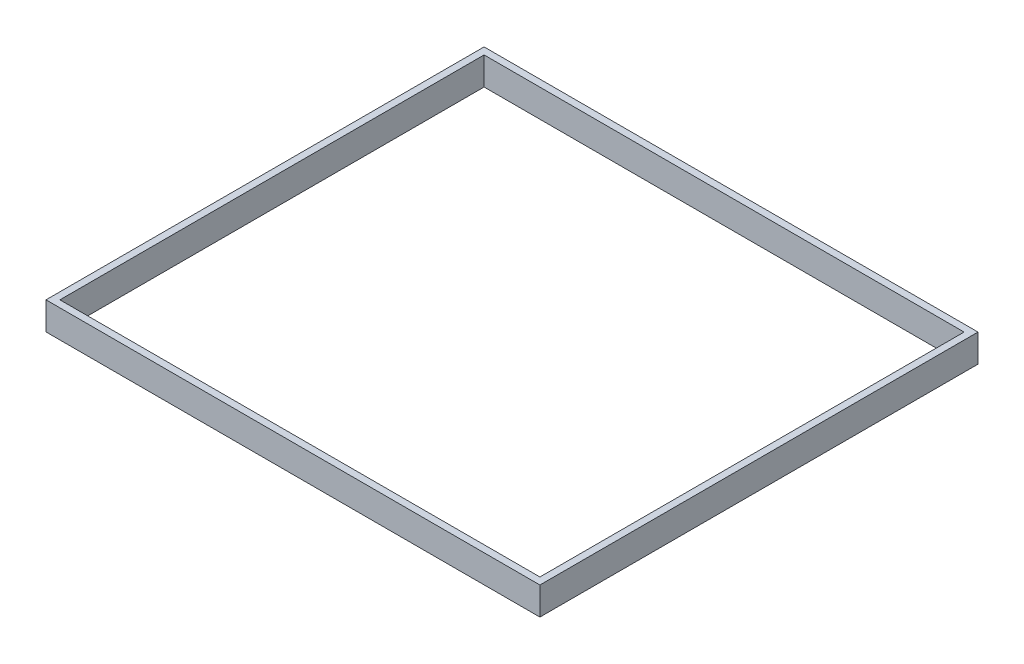
from build123d import *

# Parameters (mm, degrees)
SKETCH1_W           = 284.07405182
SKETCH1_H           = 251.972417888
SKETCH1_W_2         = 276.07405182
SKETCH1_H_2         = 243.972417888
EXTRUDE_THIN1_DEPTH = 16


with BuildPart() as part:
    # Sketch1 → Extrude-Thin1 (new body)
    with BuildSketch(Plane(origin=(0, 0, 0), x_dir=(1, 0, 0), z_dir=(0, 1, 0))):
        Rectangle(SKETCH1_W, SKETCH1_H)
        Rectangle(SKETCH1_W_2, SKETCH1_H_2, mode=Mode.SUBTRACT)
    extrude(amount=EXTRUDE_THIN1_DEPTH)


solid = part.part
